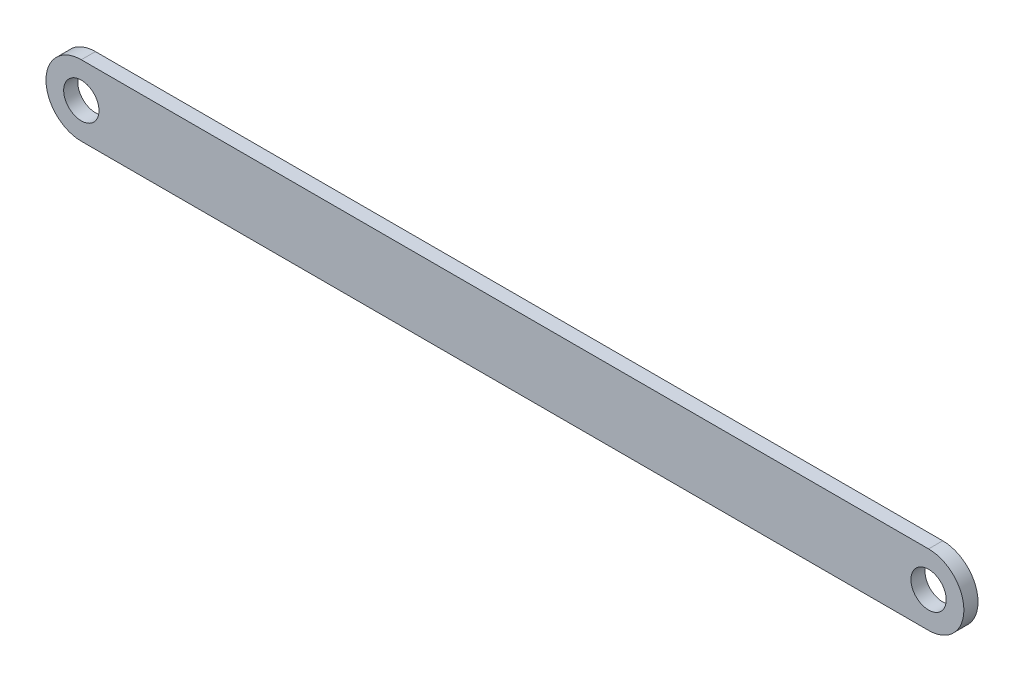
from build123d import *

# Parameters (mm, degrees)
SKETCH1_R           = 2.5
BOSS_EXTRUDE1_DEPTH = 2


with BuildPart() as part:
    # Sketch1 → Boss-Extrude1 (new body)
    with BuildSketch(Plane.XY):
        with BuildLine():
            Line((-76.212121212, 10.757575758), (43.787878788, 10.757575758))
            ThreePointArc((43.787878788, 10.757575758), (48.787878788, 5.757575758), (43.787878788, 0.757575758))
            Line((43.787878788, 0.757575758), (-76.212121212, 0.757575758))
            ThreePointArc((-76.212121212, 0.757575758), (-81.212121212, 5.757575758), (-76.212121212, 10.757575758))
        make_face()
        with Locations((-76.212121212, 5.757575758)):
            Circle(SKETCH1_R, mode=Mode.SUBTRACT)
        with Locations((43.787878788, 5.757575758)):
            Circle(SKETCH1_R, mode=Mode.SUBTRACT)
    extrude(amount=BOSS_EXTRUDE1_DEPTH)


solid = part.part
